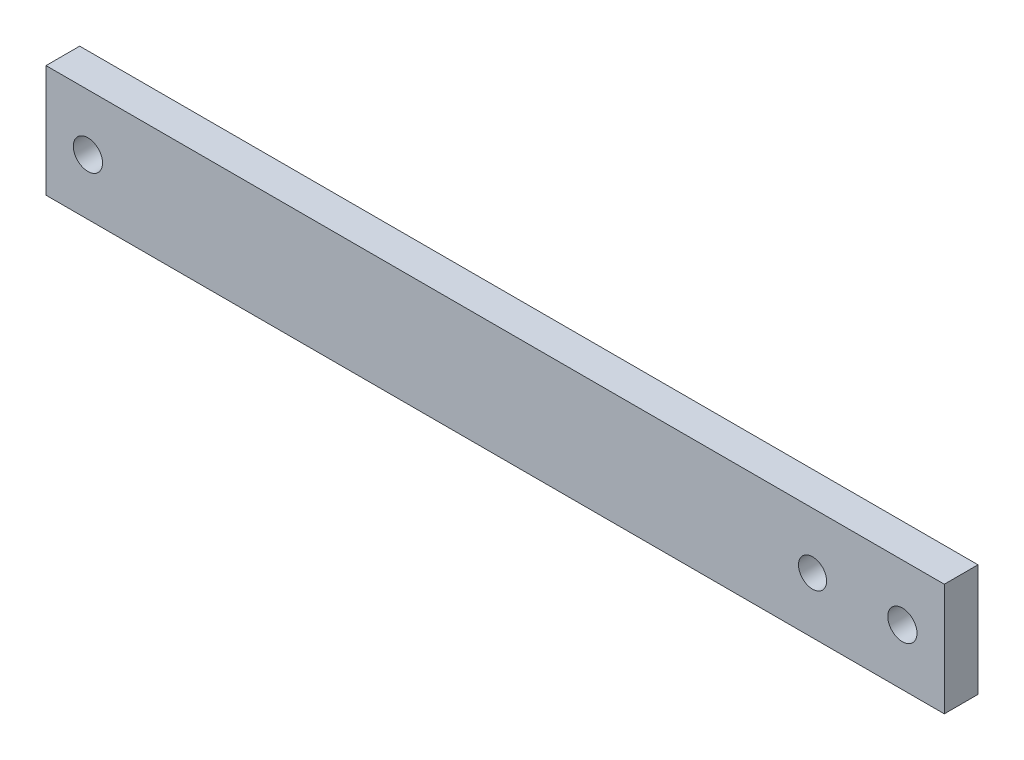
from build123d import *

# Parameters (mm, degrees)
SKETCH1_W             = 80
SKETCH1_H             = 10
SKETCH1_R             = 1.300963213
BOSS_EXTRUDE1_DEPTH   = 3
M3_TAPPED_HOLE1_D     = 2.5
M3_TAPPED_HOLE1_DEPTH = 7.5
M3_TAPPED_HOLE1_TIP   = 0.751075774


with BuildPart() as part:
    # Sketch1 → Boss-Extrude1 (new body)
    with BuildSketch(Plane.XY):
        with Locations((71.266417393, 5)):
            Rectangle(SKETCH1_W, SKETCH1_H)
        with Locations((35, 5)):
            Circle(SKETCH1_R, mode=Mode.SUBTRACT)
        with Locations(Location((107.532834786, 5, 0), (0, 0, 180))):
            Circle(SKETCH1_R, mode=Mode.SUBTRACT)
    extrude(amount=BOSS_EXTRUDE1_DEPTH)

    # M3 Tapped Hole1
    with Locations(Plane.XY.offset(3)):
        with Locations((99.532834786, 5)):
            Hole(M3_TAPPED_HOLE1_D / 2, depth=M3_TAPPED_HOLE1_DEPTH)
            with Locations((0, 0, -(M3_TAPPED_HOLE1_DEPTH + M3_TAPPED_HOLE1_TIP / 2))):  # 118° drill point
                Cone(0, M3_TAPPED_HOLE1_D / 2, M3_TAPPED_HOLE1_TIP, mode=Mode.SUBTRACT)


solid = part.part
